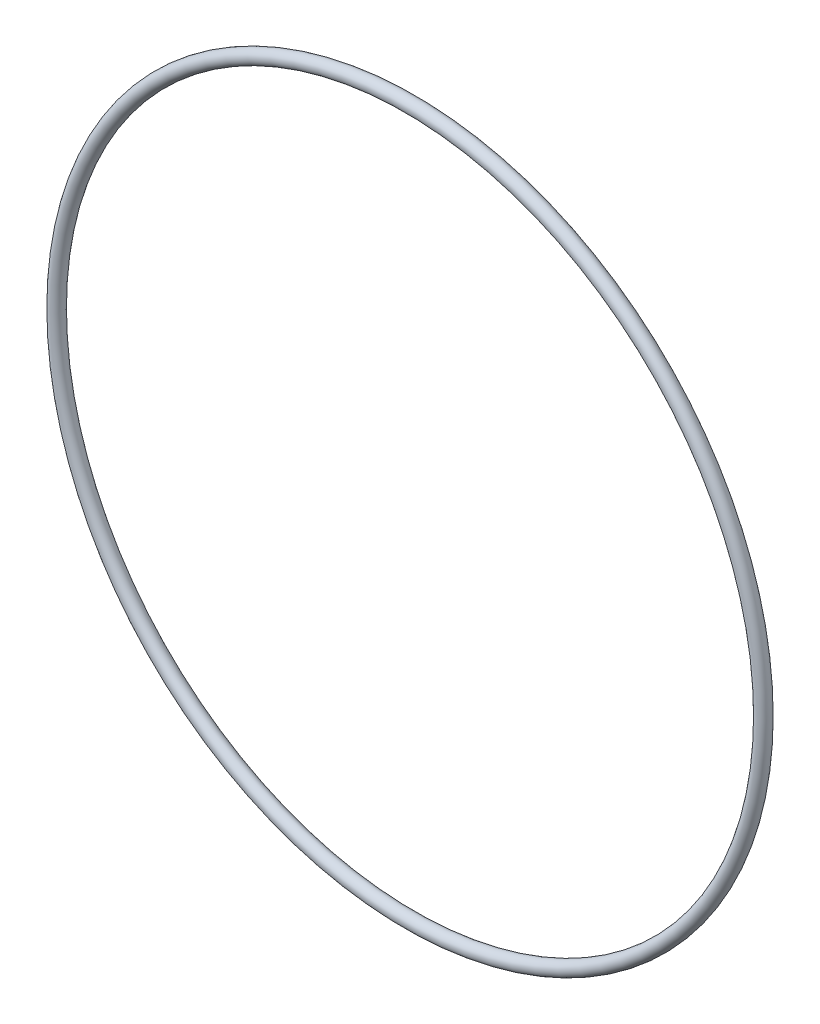
from build123d import *

# Parameters (mm, degrees)
SKETCH1_R = 0.889


with BuildPart() as part:
    # Sketch1 → Revolve1 (revolve)
    with BuildSketch(Plane(origin=(0, 0, 0), x_dir=(0, -1, 0), z_dir=(1, 0, 0)), mode=Mode.PRIVATE) as revolve1_sk:
        with Locations((45.1993, 0)):
            Circle(SKETCH1_R)
    revolve(revolve1_sk.sketch.rotate(Axis((0, 0, 0.889), (0, 0, -1)), 270), axis=Axis((0, 0, 0.889), (0, 0, -1)))


solid = part.part
